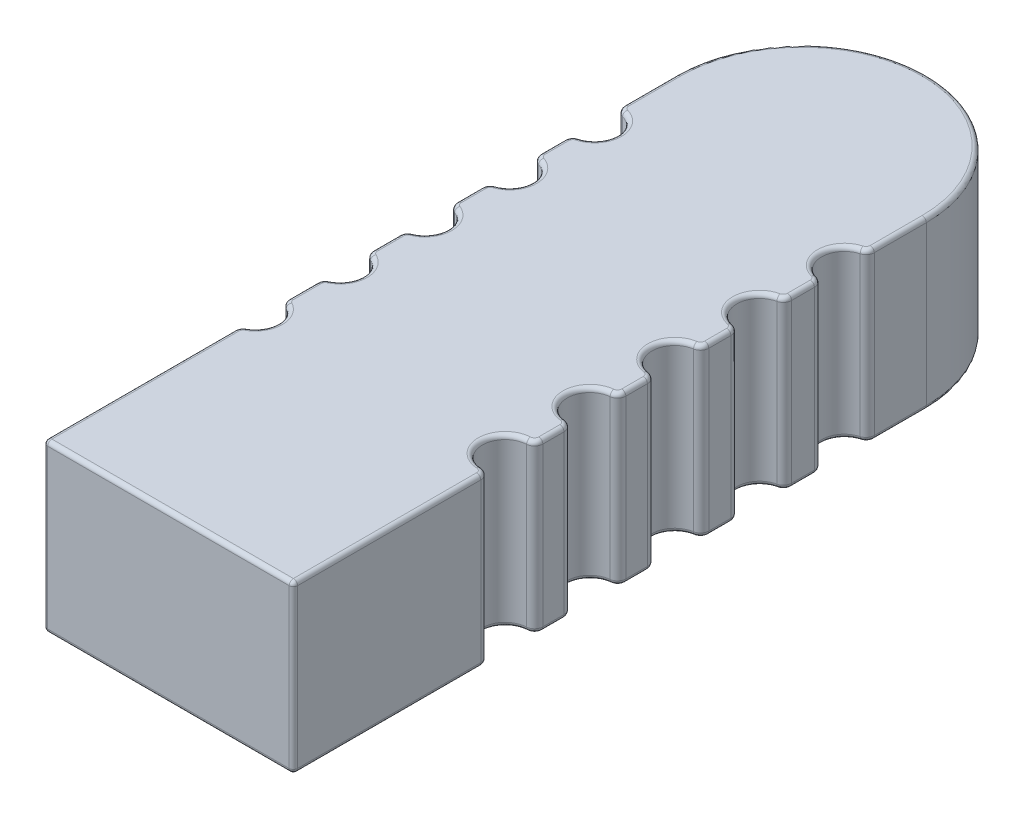
from build123d import *

# Parameters (mm, degrees)
EXTRUDE1_DEPTH = 25.4
FILLET1_R      = 0.635


with BuildPart() as part:
    # Sketch1 → Extrude1 (new body)
    with BuildSketch(Plane(origin=(0, 0, 0), x_dir=(1, 0, 0), z_dir=(0, 1, 0))):
        with BuildLine():
            Line((-19.05, 0), (19.05, 0))
            Line((19.05, 0), (19.05, 28.575))
            ThreePointArc((19.05, 28.575), (18.70177354, 29.448632383), (17.848057416, 29.843175141))
            ThreePointArc((17.848057416, 29.843175141), (14.564178571, 33.308010794), (17.848057416, 36.772846447))
            ThreePointArc((17.848057416, 36.772846447), (18.70177354, 37.167389205), (19.05, 38.041021588))
            Line((19.05, 38.041021588), (19.05, 41.275))
            ThreePointArc((19.05, 41.275), (18.724924822, 42.123538203), (17.916114833, 42.53768474))
            ThreePointArc((17.916114833, 42.53768474), (14.818178571, 45.987519833), (17.916114833, 49.437354926))
            ThreePointArc((17.916114833, 49.437354926), (18.724924822, 49.851501463), (19.05, 50.700039666))
            Line((19.05, 50.700039666), (19.05, 53.988860087))
            ThreePointArc((19.05, 53.988860087), (18.747522288, 54.811539018), (17.984172249, 55.242340719))
            ThreePointArc((17.984172249, 55.242340719), (15.072178571, 58.667028872), (17.984172249, 62.091717025))
            ThreePointArc((17.984172249, 62.091717025), (18.747522288, 62.522518726), (19.05, 63.345197656))
            Line((19.05, 63.345197656), (19.05, 66.716888769))
            ThreePointArc((19.05, 66.716888769), (18.769603879, 67.512868771), (18.052229665, 67.957368922))
            ThreePointArc((18.052229665, 67.957368922), (15.326178571, 71.346537911), (18.052229665, 74.7357069))
            ThreePointArc((18.052229665, 74.7357069), (18.769603879, 75.180207051), (19.05, 75.976187052))
            Line((19.05, 75.976187052), (19.05, 79.459537651))
            ThreePointArc((19.05, 79.459537651), (18.79120339, 80.227891543), (18.120287081, 80.683099951))
            ThreePointArc((18.120287081, 80.683099951), (15.580178571, 84.02604695), (18.120287081, 87.368993948))
            ThreePointArc((18.120287081, 87.368993948), (18.79120339, 87.824202356), (19.05, 88.592556248))
            Line((19.05, 88.592556248), (19.05, 96.52))
            ThreePointArc((19.05, 96.52), (0, 115.57), (-19.05, 96.52))
            Line((-19.05, 96.52), (-19.05, 88.592556248))
            ThreePointArc((-19.05, 88.592556248), (-18.79120339, 87.824202356), (-18.120287081, 87.368993948))
            ThreePointArc((-18.120287081, 87.368993948), (-15.580178571, 84.02604695), (-18.120287081, 80.683099951))
            ThreePointArc((-18.120287081, 80.683099951), (-18.79120339, 80.227891543), (-19.05, 79.459537651))
            Line((-19.05, 79.459537651), (-19.05, 75.83467017))
            ThreePointArc((-19.05, 75.83467017), (-18.812351082, 75.094973445), (-18.188344498, 74.632108416))
            ThreePointArc((-18.188344498, 74.632108416), (-15.834178571, 71.346537911), (-18.188344498, 68.060967405))
            ThreePointArc((-18.188344498, 68.060967405), (-18.812351082, 67.598102376), (-19.05, 66.858405652))
            Line((-19.05, 66.858405652), (-19.05, 63.060731544))
            ThreePointArc((-19.05, 63.060731544), (-18.833074174, 62.350847903), (-18.256401914, 61.883471498))
            ThreePointArc((-18.256401914, 61.883471498), (-16.088178571, 58.667028872), (-18.256401914, 55.450586245))
            ThreePointArc((-18.256401914, 55.450586245), (-18.833074174, 54.983209841), (-19.05, 54.273326199))
            Line((-19.05, 54.273326199), (-19.05, 50.269678538))
            ThreePointArc((-19.05, 50.269678538), (-18.853397259, 49.59091619), (-18.32445933, 49.12230587))
            ThreePointArc((-18.32445933, 49.12230587), (-16.342178571, 45.987519833), (-18.32445933, 42.852733795))
            ThreePointArc((-18.32445933, 42.852733795), (-18.853397259, 42.384123476), (-19.05, 41.705361128))
            Line((-19.05, 41.705361128), (-19.05, 37.46013208))
            ThreePointArc((-19.05, 37.46013208), (-18.873342643, 36.813988237), (-18.392516746, 36.347601975))
            ThreePointArc((-18.392516746, 36.347601975), (-16.596178571, 33.308010794), (-18.392516746, 30.268419613))
            ThreePointArc((-18.392516746, 30.268419613), (-18.873342643, 29.802033351), (-19.05, 29.155889508))
            Line((-19.05, 29.155889508), (-19.05, 0))
        make_face()
    extrude(amount=EXTRUDE1_DEPTH)

    # Fillet1
    fillet1_edges = [part.edges().sort_by_distance(p)[0] for p in [
        (14.564178571, 25.4, -33.308010794),
        (-16.088178571, 25.4, -58.667028872),
        (-18.833074174, 25.4, -54.983209841),
        (-19.05, 25.4, -52.271502369),
        (-18.853397259, 25.4, -49.59091619),
        (-16.342178571, 25.4, -45.987519833),
        (-18.853397259, 25.4, -42.384123476),
        (-19.05, 25.4, -39.582746604),
        (-18.873342643, 25.4, -36.813988237),
        (-16.596178571, 25.4, -33.308010794),
        (-18.873342643, 25.4, -29.802033351),
        (18.70177354, 25.4, -37.167389205),
        (-19.05, 25.4, -14.577944754),
        (0, 25.4, 0),
        (19.05, 25.4, -39.658010794),
        (18.724924822, 25.4, -42.123538203),
        (14.818178571, 25.4, -45.987519833),
        (18.724924822, 25.4, -49.851501463),
        (19.05, 25.4, -52.344449877),
        (18.747522288, 25.4, -54.811539018),
        (0, 0, 0),
        (-19.05, 0, -14.577944754),
        (-18.873342643, 0, -29.802033351),
        (-16.596178571, 0, -33.308010794),
        (-18.873342643, 0, -36.813988237),
        (15.072178571, 25.4, -58.667028872),
        (-19.05, 0, -39.582746604),
        (-18.853397259, 0, -42.384123476),
        (-16.342178571, 0, -45.987519833),
        (-18.853397259, 0, -49.59091619),
        (-19.05, 0, -52.271502369),
        (-18.833074174, 0, -54.983209841),
        (-16.088178571, 0, -58.667028872),
        (-18.833074174, 0, -62.350847903),
        (18.747522288, 25.4, -62.522518726),
        (-19.05, 0, -64.959568598),
        (-18.812351082, 0, -67.598102376),
        (-15.834178571, 0, -71.346537911),
        (-18.812351082, 0, -75.094973445),
        (-19.05, 0, -77.64710391),
        (-18.79120339, 0, -80.227891543),
        (-15.580178571, 0, -84.02604695),
        (19.05, 25.4, -14.2875),
        (19.05, 25.4, -65.031043213),
        (-18.79120339, 0, -87.824202356),
        (-19.05, 0, -92.556278124),
        (0, 0, -115.57),
        (19.05, 0, -92.556278124),
        (18.79120339, 0, -87.824202356),
        (15.580178571, 0, -84.02604695),
        (18.79120339, 0, -80.227891543),
        (19.05, 0, -77.717862352),
        (18.769603879, 25.4, -67.512868771),
        (18.769603879, 0, -75.180207051),
        (15.326178571, 0, -71.346537911),
        (18.769603879, 0, -67.512868771),
        (19.05, 0, -65.031043213),
        (18.747522288, 0, -62.522518726),
        (15.072178571, 0, -58.667028872),
        (18.747522288, 0, -54.811539018),
        (15.326178571, 25.4, -71.346537911),
        (19.05, 0, -52.344449877),
        (18.724924822, 0, -49.851501463),
        (14.818178571, 0, -45.987519833),
        (18.724924822, 0, -42.123538203),
        (19.05, 0, -39.658010794),
        (18.70177354, 0, -37.167389205),
        (14.564178571, 0, -33.308010794),
        (18.70177354, 0, -29.448632383),
        (18.769603879, 25.4, -75.180207051),
        (19.05, 0, -14.2875),
        (19.05, 25.4, -77.717862352),
        (18.79120339, 25.4, -80.227891543),
        (15.580178571, 25.4, -84.02604695),
        (18.79120339, 25.4, -87.824202356),
        (19.05, 12.7, 0),
        (-19.05, 12.7, 0),
        (19.05, 25.4, -92.556278124),
        (0, 25.4, -115.57),
        (18.70177354, 25.4, -29.448632383),
        (-19.05, 25.4, -92.556278124),
        (-18.79120339, 25.4, -87.824202356),
        (-15.580178571, 25.4, -84.02604695),
        (-18.79120339, 25.4, -80.227891543),
        (-19.05, 25.4, -77.64710391),
        (-18.812351082, 25.4, -75.094973445),
        (-15.834178571, 25.4, -71.346537911),
        (-18.812351082, 25.4, -67.598102376),
        (-19.05, 25.4, -64.959568598),
        (-18.833074174, 25.4, -62.350847903),
    ]]
    fillet(fillet1_edges, radius=FILLET1_R)


solid = part.part
